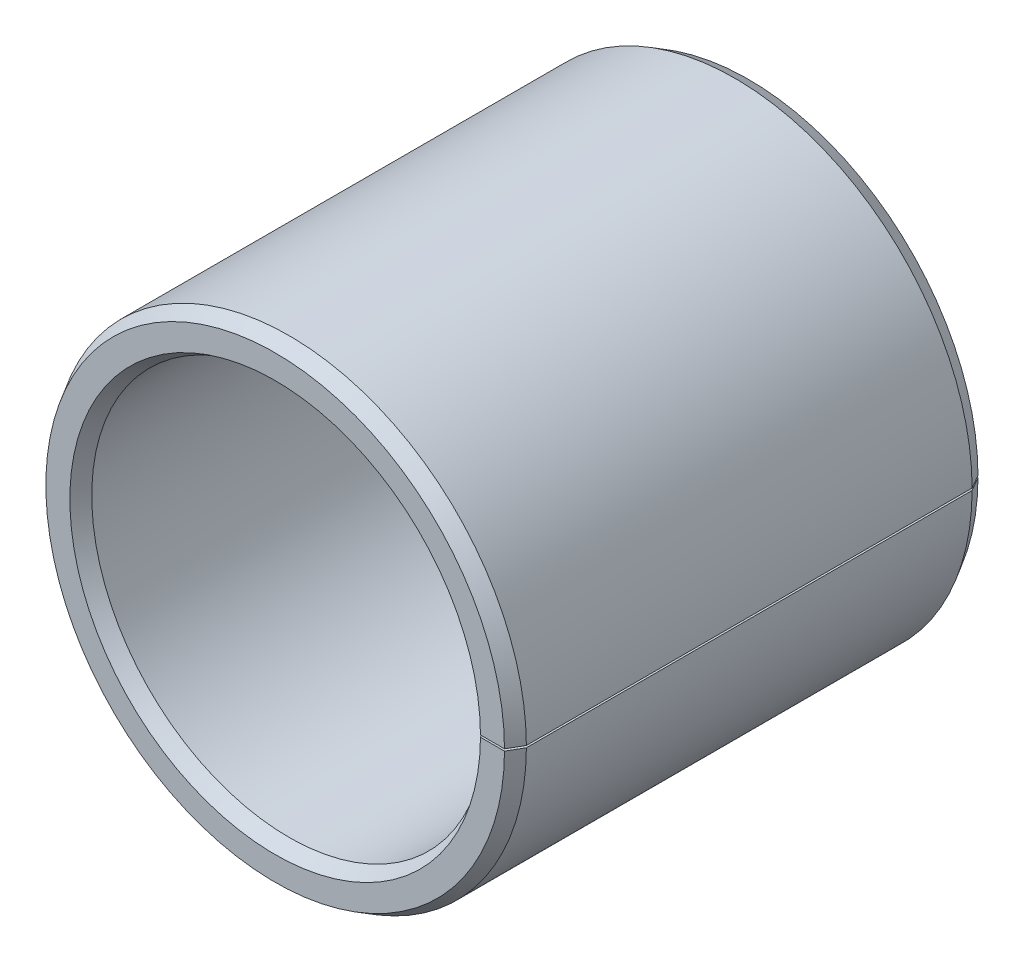
from build123d import *
from OCP.BRepFilletAPI import BRepFilletAPI_MakeChamfer

# Parameters (mm, degrees)
SKETCH3_W                = 12
SKETCH3_H                = 1.015
CHAMFER1_SIZE            = 0.203
CHAMFER1_SIZE2           = 0.351606314
CHAMFER2_SIZE            = 0.203
CHAMFER2_SIZE2           = 0.351606314
CUT_EXTRUDE1_DEPTH       = 5.648394
CUT_EXTRUDE1_DEPTH_BACK  = 5.648394
SKETCH5_R                = 5.203
BOSS_EXTRUDE1_DEPTH      = 5.648394
BOSS_EXTRUDE1_DEPTH_BACK = 5.648394
SKETCH6_R                = 5.203
SKETCH6_R_2              = 5
CUT_EXTRUDE2_DEPTH       = 11.409632558
CUT_EXTRUDE2_DEPTH_BACK  = 11.409632558
SKETCH7_W                = 6.015
SKETCH7_H                = 0.05


with BuildPart() as part:
    # Sketch3 → Revolve1 (revolve)
    with BuildSketch(Plane(origin=(0, 0, 0), x_dir=(0, 0, -1), z_dir=(1, 0, 0)), mode=Mode.PRIVATE) as revolve1_sk:
        with Locations((0, 5.5075)):
            Rectangle(SKETCH3_W, SKETCH3_H)
    revolve(revolve1_sk.sketch.rotate(Axis((0, 0, 6), (0, 0, -1)), 180), axis=Axis((0, 0, 6), (0, 0, -1)))

    # Chamfer1: one chamfer whose edges measure the first distance from different faces: ONE call of the kernel's chamfer builder (chamfer() names one face for all edges)
    chamfer1_edges_1 = [part.edges().sort_by_distance(p)[0] for p in [
        (0, 6.015, -6),
    ]]
    chamfer1_side_1 = [part.faces().sort_by_distance(p)[0] for p in [
        (0, 5.170129892, -6),
    ]]
    chamfer1_edges_2 = [part.edges().sort_by_distance(p)[0] for p in [
        (0, 5, 6),
    ]]
    chamfer1_side_2 = [part.faces().sort_by_distance(p)[0] for p in [
        (0, 5.844870108, 6),
    ]]
    chamfer1 = BRepFilletAPI_MakeChamfer(part.part.solid().wrapped)
    for e in chamfer1_edges_1:
        chamfer1.Add(CHAMFER1_SIZE, CHAMFER1_SIZE2, e.wrapped, chamfer1_side_1[0].wrapped)  # the first distance lies on this face
    for e in chamfer1_edges_2:
        chamfer1.Add(CHAMFER1_SIZE, CHAMFER1_SIZE2, e.wrapped, chamfer1_side_2[0].wrapped)  # the first distance lies on this face
    add(Compound.cast(chamfer1.Shape()), mode=Mode.REPLACE)

    # Chamfer2: one chamfer whose edges measure the first distance from different faces: ONE call of the kernel's chamfer builder (chamfer() names one face for all edges)
    chamfer2_edges_1 = [part.edges().sort_by_distance(p)[0] for p in [
        (0, 6.015, 6),
    ]]
    chamfer2_side_1 = [part.faces().sort_by_distance(p)[0] for p in [
        (0, 5.373129892, 6),
    ]]
    chamfer2_edges_2 = [part.edges().sort_by_distance(p)[0] for p in [
        (0, 5, -6),
    ]]
    chamfer2_side_2 = [part.faces().sort_by_distance(p)[0] for p in [
        (0, 5.647611816, -6),
    ]]
    chamfer2 = BRepFilletAPI_MakeChamfer(part.part.solid().wrapped)
    for e in chamfer2_edges_1:
        chamfer2.Add(CHAMFER2_SIZE, CHAMFER2_SIZE2, e.wrapped, chamfer2_side_1[0].wrapped)  # the first distance lies on this face
    for e in chamfer2_edges_2:
        chamfer2.Add(CHAMFER2_SIZE, CHAMFER2_SIZE2, e.wrapped, chamfer2_side_2[0].wrapped)  # the first distance lies on this face
    add(Compound.cast(chamfer2.Shape()), mode=Mode.REPLACE)

    # Sketch5 → Cut-Extrude1 (cut, two sides: drawn at the far end of the back side and taken through both)
    with BuildSketch(Plane.XY.offset(-CUT_EXTRUDE1_DEPTH_BACK)):
        Circle(SKETCH5_R)
    extrude(amount=CUT_EXTRUDE1_DEPTH + CUT_EXTRUDE1_DEPTH_BACK, mode=Mode.SUBTRACT)


with BuildPart() as body_2:
    # Sketch6 → Boss-Extrude1 (new, two sides: drawn at the far end of the back side and taken through both)
    with BuildSketch(Plane.XY.offset(-BOSS_EXTRUDE1_DEPTH_BACK)):
        with Locations(Location((0, 0, 0), (0, 0, 180))):
            Circle(SKETCH6_R)
        with Locations(Location((0, 0, 0), (0, 0, 180))):
            Circle(SKETCH6_R_2, mode=Mode.SUBTRACT)
    extrude(amount=BOSS_EXTRUDE1_DEPTH + BOSS_EXTRUDE1_DEPTH_BACK)


with BuildPart() as cut_extrude2_tool:
    # Sketch7 → Cut-Extrude2 (new, two sides: drawn at the far end of the back side and taken through both)
    with BuildSketch(Plane.XY.offset(-CUT_EXTRUDE2_DEPTH_BACK)):
        with Locations((3.0075, 0)):
            Rectangle(SKETCH7_W, SKETCH7_H)
    extrude(amount=CUT_EXTRUDE2_DEPTH + CUT_EXTRUDE2_DEPTH_BACK)


with BuildPart() as part_1:
    add(part.part)

    # Cut-Extrude2: cut by cut_extrude2_tool
    add(cut_extrude2_tool.part, mode=Mode.SUBTRACT)


with BuildPart() as body_2_1:
    add(body_2.part)

    # Cut-Extrude2: cut by cut_extrude2_tool
    add(cut_extrude2_tool.part, mode=Mode.SUBTRACT)


solid = Compound([part_1.part, body_2_1.part])
